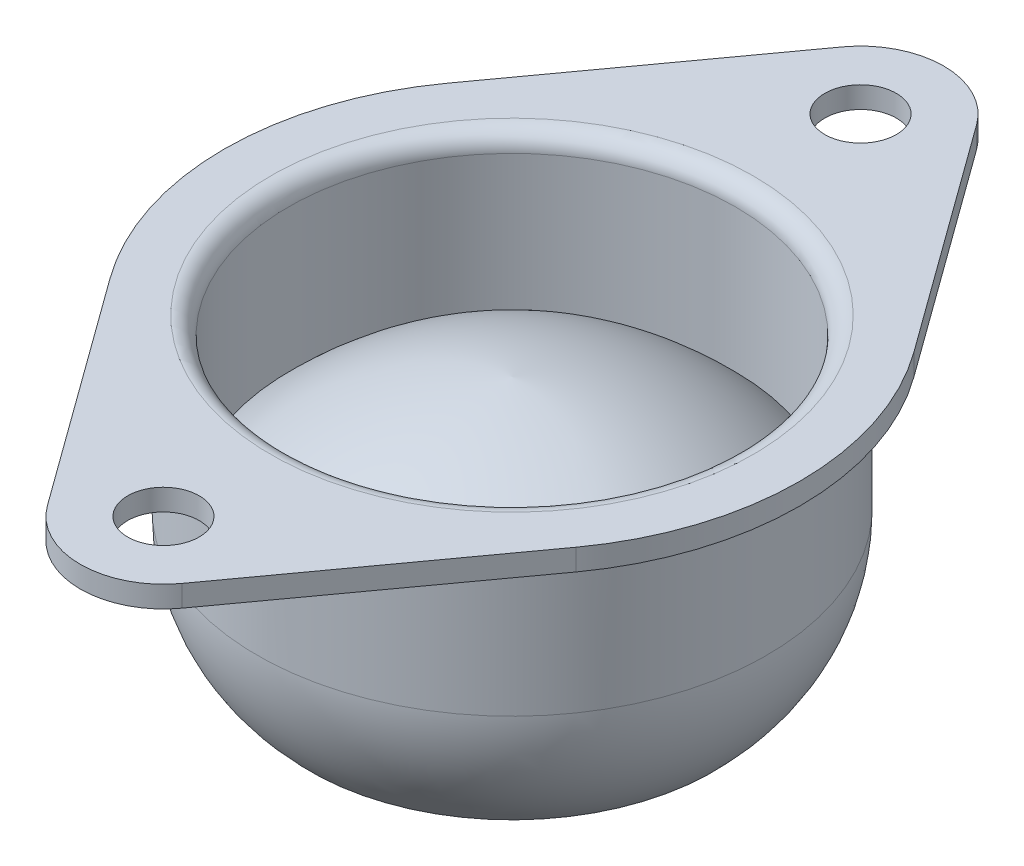
from build123d import *

# Parameters (mm, degrees)
RESSALTO_EXTRUS_O1_START = -1.2
ESBO_O2_R                = 2
RESSALTO_EXTRUS_O1_DEPTH = 1.2
FILETE1_R                = 1
FILETE2_R                = 1
ESCALA1_SCALE            = 0.571428571


with BuildPart() as part:
    # Esboço1 → Revolução1 (revolve)
    with BuildSketch(Plane.XY, mode=Mode.PRIVATE) as revolu_o1_sk:
        with BuildLine():
            Line((0, 0), (-16.1, 0))
            Line((-16.1, 0), (-16.1, -1.2))
            Line((-16.1, -1.2), (-14.25, -1.2))
            Line((-14.25, -1.2), (-14.25, -9.358571571))
            ThreePointArc((-14.25, -9.358571571), (-13.469544457, -13.231554918), (-11.25, -16.5))
            ThreePointArc((-11.25, -16.5), (-9.286251005, -16.915617464), (-7.5, -16))
            ThreePointArc((-7.5, -16), (-4.506939094, -19.635408641), (0, -21))
            Line((0, -21), (0, 0))
        make_face()
    revolve(revolu_o1_sk.sketch.rotate(Axis((0, 0, 0), (0, 1, 0)), 270), axis=Axis((0, 0, 0), (0, 1, 0)))

    # Esboço2 → Ressalto-extrusão1 (add)
    # profile 1 of 2: a face of its own
    with BuildSketch(Plane(origin=(0, 0, 0), x_dir=(1, 0, 0), z_dir=(0, 1, 0)).offset(RESSALTO_EXTRUS_O1_START)):
        with BuildLine():
            Line((13.032253871, 9.453589744), (3.763973944, 22.230384615))
            ThreePointArc((3.763973944, 22.230384615), (0, 24.15), (-3.763973944, 22.230384615))
            Line((-3.763973944, 22.230384615), (-13.032253871, 9.453589744))
            ThreePointArc((-13.032253871, 9.453589744), (0, 16.1), (13.032253871, 9.453589744))
        make_face()
        with Locations(Location((0, 19.5, 0), (0, 0, 270))):
            Circle(ESBO_O2_R, mode=Mode.SUBTRACT)
    # profile 2 of 2: a face of its own
    with BuildSketch(Plane(origin=(0, 0, 0), x_dir=(1, 0, 0), z_dir=(0, 1, 0)).offset(RESSALTO_EXTRUS_O1_START)):
        with BuildLine():
            Line((3.763973944, -22.230384615), (13.032253871, -9.453589744))
            ThreePointArc((13.032253871, -9.453589744), (0, -16.1), (-13.032253871, -9.453589744))
            Line((-13.032253871, -9.453589744), (-3.763973944, -22.230384615))
            ThreePointArc((-3.763973944, -22.230384615), (0, -24.15), (3.763973944, -22.230384615))
        make_face()
        with Locations(Location((0, -19.5, 0), (0, 0, 270))):
            Circle(ESBO_O2_R, mode=Mode.SUBTRACT)
    extrude(amount=RESSALTO_EXTRUS_O1_DEPTH)

    # Esboço3 → Corte-Revolução1 (revolve, cut)
    with BuildSketch(Plane(origin=(0, 0, 0), x_dir=(0, 0, -1), z_dir=(1, 0, 0)), mode=Mode.PRIVATE) as corte_revolu_o1_sk:
        with BuildLine():
            Line((-12.5, 0), (-12.5, -9))
            ThreePointArc((-12.5, -9), (-6.786587677, -4.882109006), (0, -3))
            Line((0, -3), (0, 0))
            Line((0, 0), (-12.5, 0))
        make_face()
    revolve(corte_revolu_o1_sk.sketch.rotate(Axis((0, 0, 0), (0, -1, 0)), 90), axis=Axis((0, 0, 0), (0, -1, 0)), mode=Mode.SUBTRACT)

    # Filete1
    filete1_edges = [part.edges().sort_by_distance(p)[0] for p in [
        (12.5, 0, 0),
    ]]
    fillet(filete1_edges, radius=FILETE1_R)

    # Filete2
    filete2_edges = [part.edges().sort_by_distance(p)[0] for p in [
        (0, -1.2, 14.25),
    ]]
    fillet(filete2_edges, radius=FILETE2_R)


with BuildPart() as part_1:
    # Escala1: scaled about (0, -9.829669645, 0)
    add(part.part.scale(ESCALA1_SCALE).moved(Location((0, -4.212715562, 0))))


solid = part_1.part
